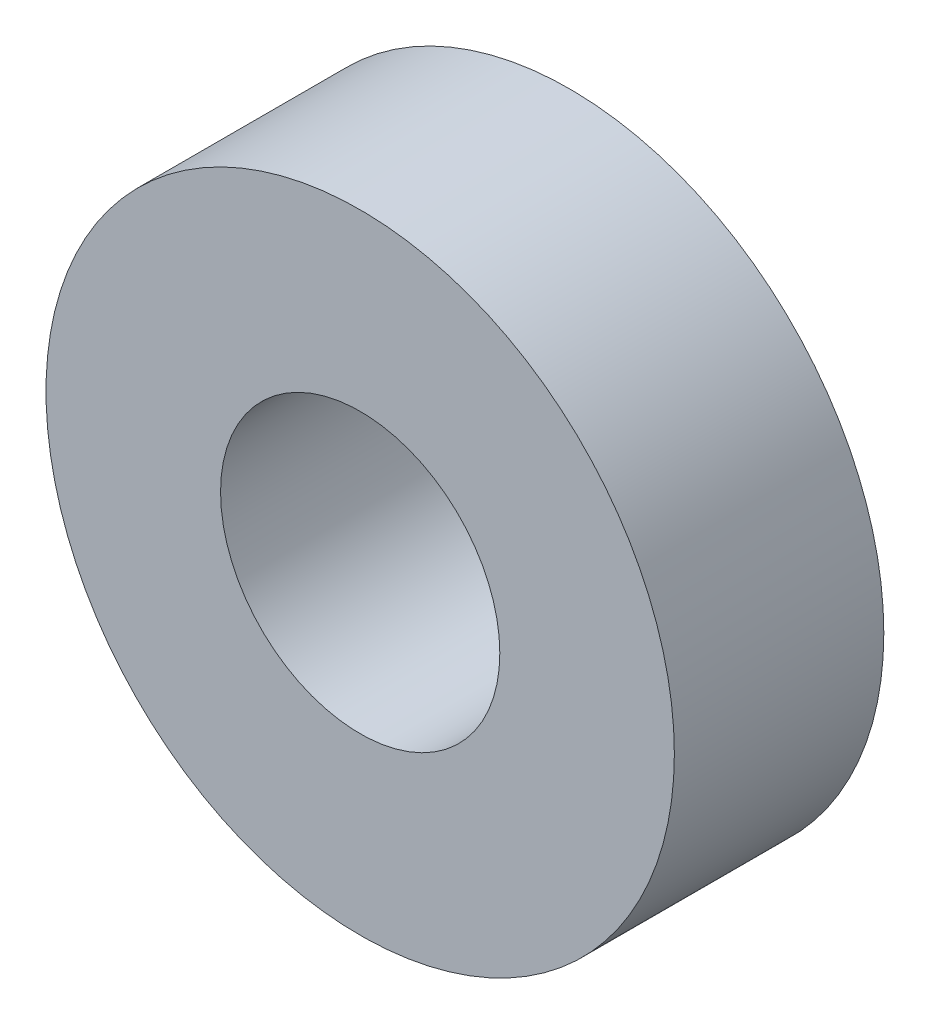
from build123d import *

# Parameters (mm, degrees)
SKETCH_1_R      = 4.5
SKETCH_1_R_2    = 2
EXTRUDE_1_DEPTH = 3


with BuildPart() as part:
    # 草圖1 → 填料-伸長1 (new body)
    with BuildSketch(Plane.XY):
        Circle(SKETCH_1_R)
        Circle(SKETCH_1_R_2, mode=Mode.SUBTRACT)
    extrude(amount=EXTRUDE_1_DEPTH)


solid = part.part
